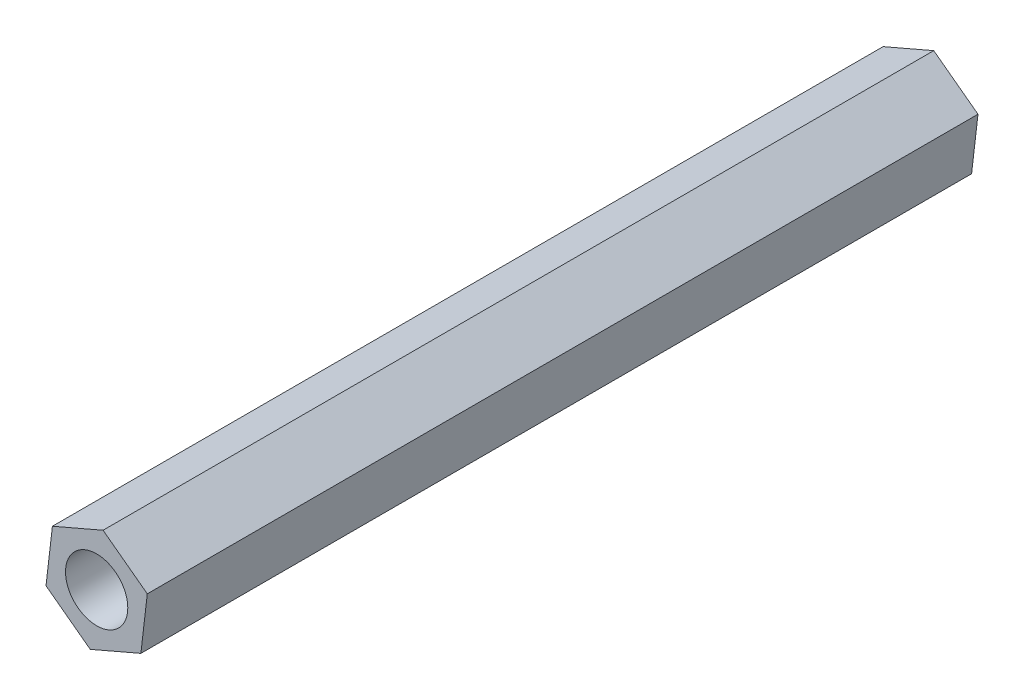
from build123d import *

# Parameters (mm, degrees)
EXTRUDE_2_DEPTH     = 40
SKETCH_3_R          = 1.5
CUT_EXTRUDE_1_DEPTH = 41.160993


with BuildPart() as part:
    # 草图1 → 凸台-拉伸2 (new body)
    with BuildSketch(Plane.XY):
        Polygon((2.130163268, -1.586107747), (2.438691236, 1.05172163), (0.308527968, 2.637829378), (-2.130163268, 1.586107747), (-2.438691236, -1.05172163), (-0.308527968, -2.637829378), align=None)
    extrude(amount=EXTRUDE_2_DEPTH)

    # 草图3 → 切除-拉伸1 (cut, through all)
    with BuildSketch(Plane.XY.offset(40)):
        Circle(SKETCH_3_R)
    extrude(amount=-CUT_EXTRUDE_1_DEPTH, mode=Mode.SUBTRACT)


solid = part.part
